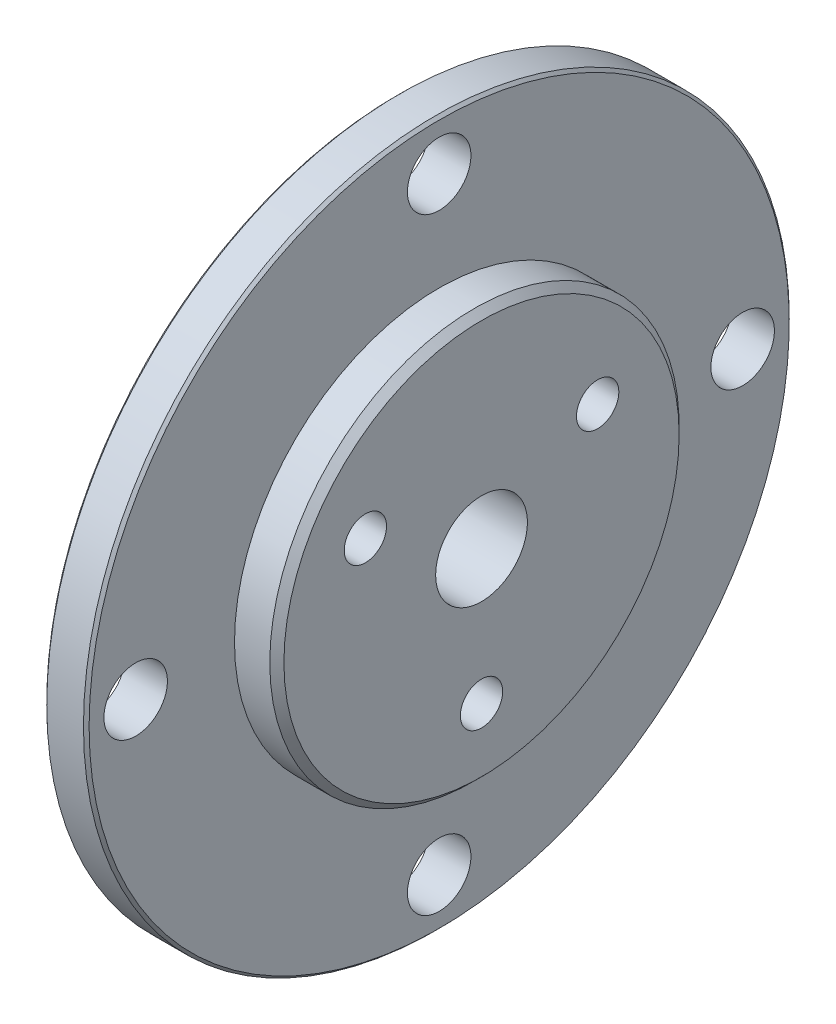
from build123d import *

# Parameters (mm, degrees)
CHANFREIN1_SIZE                    = 0.5
CHANFREIN2_SIZE                    = 0.2
ESQUISSE2_R                        = 1.5
TROU_DE_FIXATION_DU_MOTEUR_DEPTH   = 36.860842154
R_P_TITION_DES_3_TROUS_COUNT       = 3
ESQUISSE3_R                        = 2.25
TROU_DE_FIXATION_DE_LA_BRIDE_DEPTH = 36.860842154
R_P_TITION_DES_4_TROUS_COUNT       = 4


with BuildPart() as part:
    # Esquisse1 → Base-Révolution (revolve)
    with BuildSketch(Plane.XY):
        Polygon((-3, 3.25), (-3, 25), (0, 25), (0, 14.5), (3, 14.5), (3, 3.25), align=None)
    revolve(axis=Axis((-30.73022942, 0, 0), (1, 0, 0)))

    # Chanfrein1
    chanfrein1_edges = [part.edges().sort_by_distance(p)[0] for p in [
        (3, -14.5, 0),
    ]]
    chamfer(chanfrein1_edges, length=CHANFREIN1_SIZE)

    # Chanfrein2
    chanfrein2_edges = [part.edges().sort_by_distance(p)[0] for p in [
        (-3, -25, 0),
        (0, -25, 0),
    ]]
    chamfer(chanfrein2_edges, length=CHANFREIN2_SIZE)

    # Esquisse2 → Trou de fixation du moteur (cut, through all)
    with BuildSketch(Plane(origin=(3, 0, 0), x_dir=(0, 0, -1), z_dir=(1, 0, 0))):
        with Locations((-8.227241336, 4.75)):
            Circle(ESQUISSE2_R)
    trou_de_fixation_du_moteur = extrude(amount=-TROU_DE_FIXATION_DU_MOTEUR_DEPTH, mode=Mode.SUBTRACT)

    # Répétition des 3 trous: Trou de fixation du moteur ×3 about axis
    r_p_tition_des_3_trous_axis = Axis((19.26977058, 0, 0), (-1, 0, 0))
    for i in range(1, R_P_TITION_DES_3_TROUS_COUNT):
        add(trou_de_fixation_du_moteur.rotate(r_p_tition_des_3_trous_axis, i * 360 / R_P_TITION_DES_3_TROUS_COUNT), mode=Mode.SUBTRACT)

    # Esquisse3 → Trou de fixation de la bride (cut, through all)
    with BuildSketch(Plane.ZY.offset(3)):
        with Locations((0, 21.5)):
            Circle(ESQUISSE3_R)
    trou_de_fixation_de_la_bride = extrude(amount=-TROU_DE_FIXATION_DE_LA_BRIDE_DEPTH, mode=Mode.SUBTRACT)

    # Répétition des 4 trous: Trou de fixation de la bride ×4 about axis
    r_p_tition_des_4_trous_axis = Axis((19.26977058, 0, 0), (-1, 0, 0))
    for i in range(1, R_P_TITION_DES_4_TROUS_COUNT):
        add(trou_de_fixation_de_la_bride.rotate(r_p_tition_des_4_trous_axis, i * 360 / R_P_TITION_DES_4_TROUS_COUNT), mode=Mode.SUBTRACT)


solid = part.part
